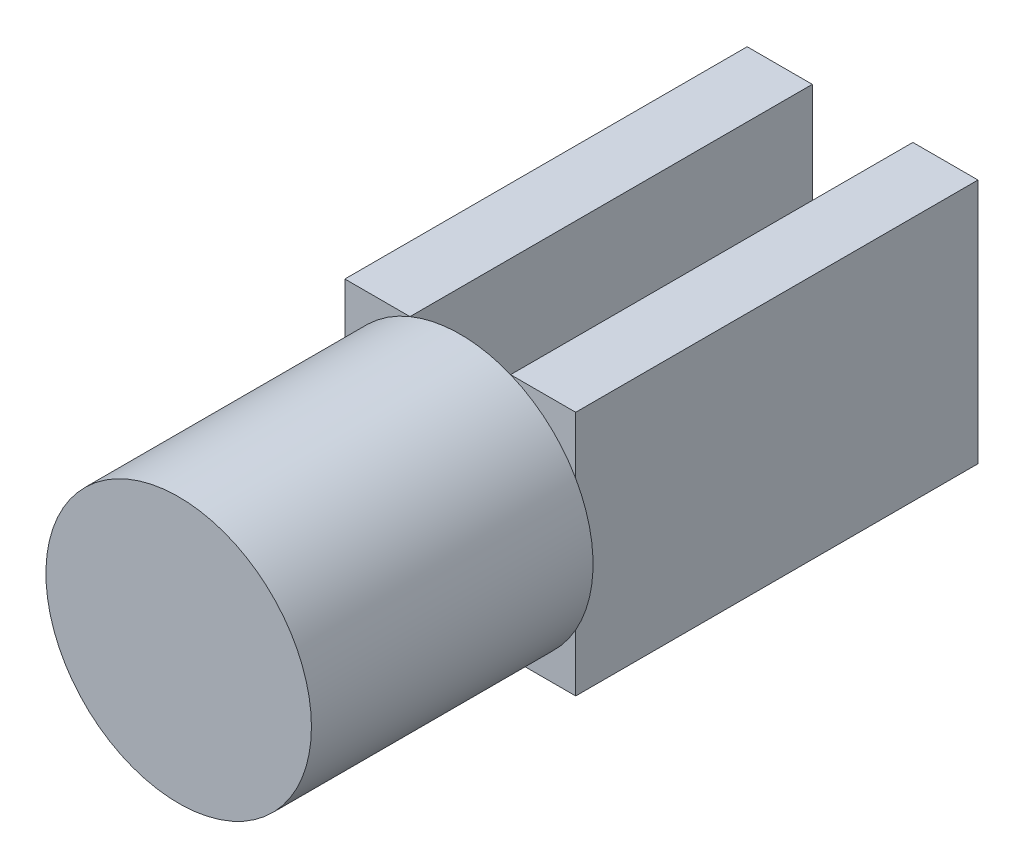
from build123d import *

# Parameters (mm, degrees)
SKETCH_1_R      = 33
EXTRUDE_1_DEPTH = 70
SKETCH_2_W      = 16.190565304
SKETCH_2_H      = 61.081912216
EXTRUDE_3_DEPTH = 100


with BuildPart() as part:
    # 草图1 → 凸台-拉伸1 (new body)
    with BuildSketch(Plane.XY):
        Circle(SKETCH_1_R)
    extrude(amount=EXTRUDE_1_DEPTH)

    # 草图2 → 凸台-拉伸3 (add)
    with BuildSketch(Plane(origin=(0, 0, 0), x_dir=(-1, 0, 0), z_dir=(0, 0, -1))):
        with Locations((-20.595282652, 0)):
            Rectangle(SKETCH_2_W, SKETCH_2_H)
        with Locations((20.595282652, 0)):
            Rectangle(SKETCH_2_W, SKETCH_2_H)
    extrude(amount=EXTRUDE_3_DEPTH)


solid = part.part
